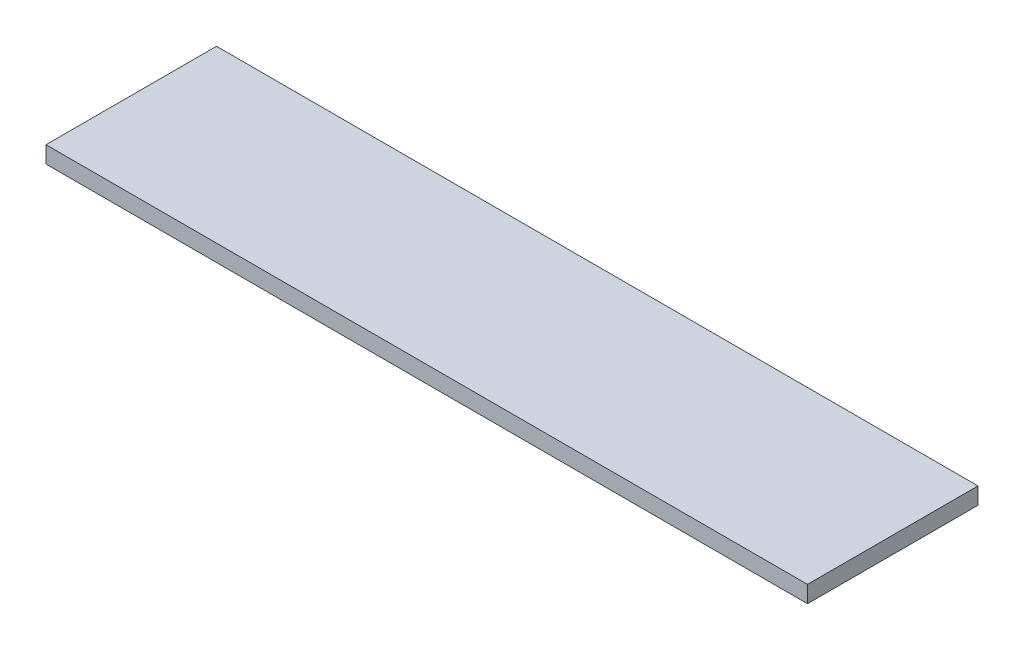
from build123d import *

# Parameters (mm, degrees)
SKETCH1_W           = 90.75
SKETCH1_H           = 20.32
BOSS_EXTRUDE1_DEPTH = 2


with BuildPart() as part:
    # Sketch1 → Boss-Extrude1 (new body)
    with BuildSketch(Plane(origin=(0, 0, 0), x_dir=(1, 0, 0), z_dir=(0, 1, 0))):
        Rectangle(SKETCH1_W, SKETCH1_H)
    extrude(amount=BOSS_EXTRUDE1_DEPTH)


solid = part.part
